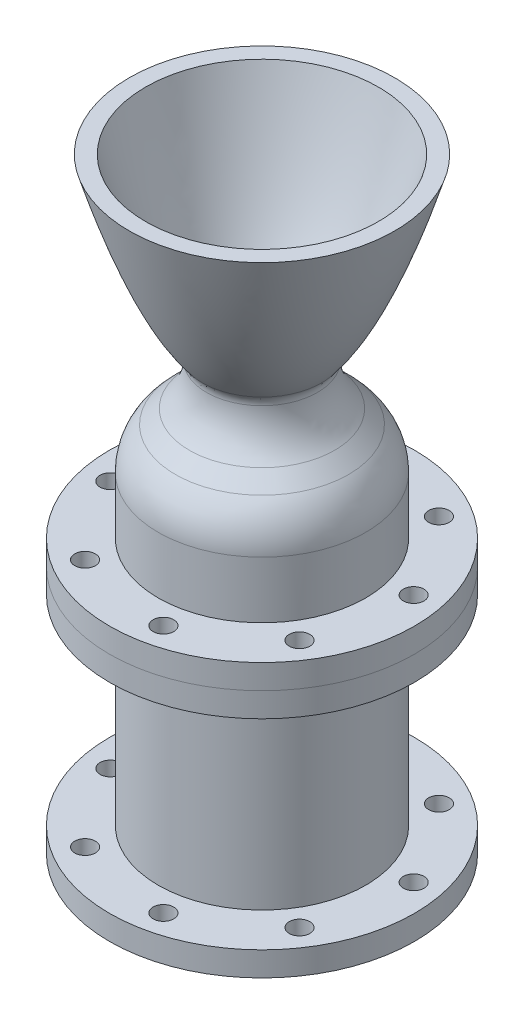
from build123d import *

# Parameters (mm, degrees)
SKETCH2_R           = 93.881527661
SKETCH2_R_2         = 63.881527661
BOSS_EXTRUDE1_DEPTH = 15
BOSS_EXTRUDE2_START = 15
SKETCH3_R           = 93.881527661
SKETCH3_R_2         = 63.881527661
BOSS_EXTRUDE2_DEPTH = 15
CIRPATTERN1_COUNT   = 8


with BuildPart() as part:
    # Sketch1 → Revolve2 (revolve)
    with BuildSketch(Plane.XY, mode=Mode.PRIVATE) as revolve2_sk:
        with BuildLine():
            Line((71.727523603, 109.92750764), (81.727523603, 109.92750764))
            add(Edge.make_bspline(
                [(36.834819916, 6.492229985), (59.290187444, 34.627531396), (81.727523603, 109.92750764)],
                knots=[0, 0, 0, 1, 1, 1], degree=2))
            add(Edge.make_bspline(
                [(34.138608587, -0.017009666), (34.138609214, 0.018882986), (34.139147045, 0.093104024), (34.141564436, 0.250631404), (34.148002281, 0.410054451), (34.160074312, 0.629754601), (34.1809758, 0.884423662), (34.214725432, 1.185527607), (34.266040019, 1.525040832), (34.330084415, 1.863987111), (34.406682315, 2.199344754), (34.495864285, 2.532229755), (34.597282126, 2.861082979), (34.711159784, 3.186337375), (34.836737485, 3.506617492), (34.97482669, 3.822657067), (35.123611014, 4.132272519), (35.285552936, 4.437773457), (35.456029218, 4.73429191), (35.642055434, 5.028694196), (35.831328983, 5.30850927), (36.043946188, 5.593717877), (36.218417088, 5.815903982), (36.405886469, 6.032941971), (36.544095961, 6.19163198), (36.709982784, 6.365112113), (36.784060974, 6.441469176), (36.834819916, 6.492229985)],
                knots=[0.082568816, 0.082568816, 0.082568816, 0.082568816, 0.082568816, 0.102426634, 0.122284453, 0.142142271, 0.162000089, 0.201715725, 0.241431362, 0.281146998, 0.320862634, 0.360578271, 0.400293907, 0.440009544, 0.47972518, 0.519440816, 0.559156453, 0.598872089, 0.638587725, 0.678303362, 0.718018998, 0.757734635, 0.797450271, 0.837165907, 0.857023726, 0.876881544, 0.91659718, 0.91659718, 0.91659718, 0.91659718, 0.91659718], degree=4))
            add(Edge.make_bspline(
                [(34.138608587, -0.017009666), (34.138609818, -0.087538311), (34.139138965, -0.230593854), (34.141514651, -0.56019258), (34.147839045, -0.841170061), (34.157324166, -1.211831735), (34.169966459, -1.530444722), (34.185766683, -1.878949267), (34.204721942, -2.210716536), (34.232359556, -2.635079064), (34.271827763, -3.139043611), (34.342840424, -3.896988339), (34.462667396, -4.903460052), (34.639026763, -6.073720425), (34.890425953, -7.40217608), (35.191336035, -8.72058418), (35.541311346, -10.026646874), (35.939901707, -11.318829263), (36.386486117, -12.595109002), (36.880544049, -13.853897151), (37.42121385, -15.093206797), (38.008020115, -16.311619463), (38.639680128, -17.506948464), (39.316073127, -18.678297428), (40.034985834, -19.822753068), (40.797562733, -20.940869747), (41.498707927, -21.891421434), (42.128276858, -22.690455155), (42.663669152, -23.337431813), (43.111796504, -23.857014692), (43.547990763, -24.346825923), (43.975366859, -24.805494067), (44.285099377, -25.130877988), (44.576400695, -25.426658725), (44.675953163, -25.52695961), (44.725823541, -25.576831795)],
                knots=[0.082637729, 0.082637729, 0.082637729, 0.082637729, 0.082637729, 0.092574926, 0.102512123, 0.11244932, 0.122386517, 0.132323714, 0.142260911, 0.152198108, 0.162135305, 0.182009699, 0.201884093, 0.24163288, 0.281381668, 0.321130456, 0.360879243, 0.400628031, 0.440376819, 0.480125606, 0.519874394, 0.559623181, 0.599371969, 0.639120757, 0.678869544, 0.718618332, 0.75836712, 0.798115907, 0.817990301, 0.837864695, 0.857739089, 0.877613483, 0.897487877, 0.907425074, 0.91736227, 0.91736227, 0.91736227, 0.91736227, 0.91736227], degree=4))
            Line((44.725823541, -25.576831795), (53.333451739, -34.184459993))
            add(Edge.make_bspline(
                [(63.881527661, -59.7610264), (63.881635503, -59.690496419), (63.881325305, -59.548918717), (63.879465733, -59.215073955), (63.873569156, -58.938295382), (63.864659319, -58.566053153), (63.852510889, -58.246304117), (63.833426989, -57.81503091), (63.804188899, -57.314350552), (63.760893785, -56.721321154), (63.683287498, -55.881682335), (63.584725547, -55.041214402), (63.465267047, -54.205298233), (63.29694877, -53.205026548), (63.103741077, -52.20974415), (62.879581588, -51.220492573), (62.624738162, -50.239047247), (62.34552051, -49.264202982), (62.042075876, -48.296624041), (61.652992584, -47.179186843), (61.160922286, -45.919697704), (60.622053079, -44.679423275), (60.037264967, -43.460250183), (59.407173996, -42.26366605), (58.732990622, -41.091683685), (58.015112762, -39.945389917), (57.255467536, -38.827317394), (56.553708502, -37.873606552), (55.928608776, -37.076859239), (55.388897914, -36.423732972), (54.951995064, -35.913923057), (54.55233645, -35.466049486), (54.219578542, -35.103172981), (53.912547537, -34.778406744), (53.713018447, -34.569307229), (53.483698766, -34.335919151), (53.383246706, -34.234409451), (53.333451739, -34.184459993)],
                knots=[0.082637729, 0.082637729, 0.082637729, 0.082637729, 0.082637729, 0.092574926, 0.102512123, 0.11244932, 0.122386517, 0.132323714, 0.142260911, 0.162135305, 0.182009699, 0.201884093, 0.24163288, 0.261507274, 0.281381668, 0.321130456, 0.360879243, 0.380753637, 0.400628031, 0.440376819, 0.480125606, 0.519874394, 0.559623181, 0.599371969, 0.639120757, 0.678869544, 0.718618332, 0.75836712, 0.798115907, 0.817990301, 0.837864695, 0.857739089, 0.877613483, 0.88755068, 0.897487877, 0.907425074, 0.91736227, 0.91736227, 0.91736227, 0.91736227, 0.91736227], degree=4))
            Line((63.881527661, -59.7610264), (63.881527661, -262.944683548))
            Line((63.881527661, -262.944683548), (53.881527661, -262.927513222))
            Line((53.881527661, -262.927513222), (53.881527661, -59.727513222))
            add(Edge.make_bspline(
                [(53.881527661, -59.727513222), (53.88152643, -59.656983159), (53.880997287, -59.515406106), (53.878621437, -59.181564619), (53.872296838, -58.904795495), (53.862811351, -58.53256749), (53.850168453, -58.212837625), (53.830417626, -57.781594445), (53.800405285, -57.280959902), (53.756193122, -56.687998168), (53.677288452, -55.848480369), (53.577426862, -55.008165863), (53.456675787, -54.172435433), (53.286810823, -53.172425243), (53.092064187, -52.177442824), (52.866375121, -51.188539086), (52.610014225, -50.207489041), (52.329289341, -49.233077743), (52.02434874, -48.265969226), (51.633537832, -47.14913507), (51.139520362, -45.890408408), (50.598733754, -44.650968806), (50.012060929, -43.432701528), (49.380120232, -42.237093241), (48.70412523, -41.066154881), (47.984475521, -39.92097266), (47.223102139, -38.804076241), (46.519869062, -37.851451787), (45.893537939, -37.055672125), (45.352817682, -36.403381284), (44.91512695, -35.894247635), (44.514776191, -35.446992659), (44.181457505, -35.084631187), (43.873924626, -34.760340153), (43.674072408, -34.551549453), (43.444392074, -34.31851629), (43.343783153, -34.217162057), (43.293911001, -34.167289665)],
                knots=[0.082637729, 0.082637729, 0.082637729, 0.082637729, 0.082637729, 0.092574926, 0.102512123, 0.11244932, 0.122386517, 0.132323714, 0.142260911, 0.162135305, 0.182009699, 0.201884093, 0.24163288, 0.261507274, 0.281381668, 0.321130456, 0.360879243, 0.380753637, 0.400628031, 0.440376819, 0.480125606, 0.519874394, 0.559623181, 0.599371969, 0.639120757, 0.678869544, 0.718618332, 0.75836712, 0.798115907, 0.817990301, 0.837864695, 0.857739089, 0.877613483, 0.88755068, 0.897487877, 0.907425074, 0.91736227, 0.91736227, 0.91736227, 0.91736227, 0.91736227], degree=4))
            Line((43.293911001, -34.167289665), (34.686282803, -25.559661467))
            add(Edge.make_bspline(
                [(24.099067874, 0.000160672), (24.099069105, -0.070367973), (24.099598252, -0.213423516), (24.101973937, -0.543022242), (24.108298331, -0.823999723), (24.117783452, -1.194661398), (24.130425744, -1.513274384), (24.146225968, -1.861778929), (24.165181227, -2.193546198), (24.19281884, -2.617908726), (24.232287047, -3.121873273), (24.303299707, -3.879818001), (24.423126678, -4.886289715), (24.599486044, -6.056550087), (24.850885233, -7.385005742), (25.151795313, -8.703413843), (25.501770623, -10.009476538), (25.900360983, -11.301658927), (26.346945391, -12.577938666), (26.841003322, -13.836726816), (27.381673121, -15.076036462), (27.968479386, -16.294449129), (28.600139397, -17.48977813), (29.276532395, -18.661127095), (29.995445101, -19.805582736), (30.758021999, -20.923699416), (31.459167192, -21.874251103), (32.088736123, -22.673284825), (32.624128416, -23.320261484), (33.072255768, -23.839844363), (33.508450026, -24.329655594), (33.935826121, -24.788323738), (34.245558639, -25.11370766), (34.536859957, -25.409488397), (34.636412425, -25.509789282), (34.686282803, -25.559661467)],
                knots=[0.082637729, 0.082637729, 0.082637729, 0.082637729, 0.082637729, 0.092574926, 0.102512123, 0.11244932, 0.122386517, 0.132323714, 0.142260911, 0.152198108, 0.162135305, 0.182009699, 0.201884093, 0.24163288, 0.281381668, 0.321130456, 0.360879243, 0.400628031, 0.440376819, 0.480125606, 0.519874394, 0.559623181, 0.599371969, 0.639120757, 0.678869544, 0.718618332, 0.75836712, 0.798115907, 0.817990301, 0.837864695, 0.857739089, 0.877613483, 0.897487877, 0.907425074, 0.91736227, 0.91736227, 0.91736227, 0.91736227, 0.91736227], degree=4))
            add(Edge.make_bspline(
                [(24.099067874, 0.000160672), (24.0990685, 0.036053324), (24.099606331, 0.110274362), (24.102023723, 0.267801742), (24.108461568, 0.427224789), (24.120533599, 0.646924939), (24.141435087, 0.901594), (24.175184719, 1.202697945), (24.226499305, 1.54221117), (24.290543701, 1.881157449), (24.367141601, 2.216515092), (24.456323571, 2.549400093), (24.557741413, 2.878253317), (24.671619071, 3.203507713), (24.797196771, 3.523787829), (24.935285977, 3.839827405), (25.084070301, 4.149442857), (25.246012222, 4.454943795), (25.416488505, 4.751462248), (25.602514721, 5.045864533), (25.79178827, 5.325679608), (26.004405474, 5.610888215), (26.178876374, 5.83307432), (26.366345756, 6.050112309), (26.504555248, 6.208802318), (26.67044207, 6.382282451), (26.744520261, 6.458639514), (26.795279203, 6.509400323)],
                knots=[0.082568816, 0.082568816, 0.082568816, 0.082568816, 0.082568816, 0.102426634, 0.122284453, 0.142142271, 0.162000089, 0.201715725, 0.241431362, 0.281146998, 0.320862634, 0.360578271, 0.400293907, 0.440009544, 0.47972518, 0.519440816, 0.559156453, 0.598872089, 0.638587725, 0.678303362, 0.718018998, 0.757734635, 0.797450271, 0.837165907, 0.857023726, 0.876881544, 0.91659718, 0.91659718, 0.91659718, 0.91659718, 0.91659718], degree=4))
            add(Edge.make_bspline(
                [(26.795279203, 6.509400323), (49.261401403, 34.636114842), (71.727523603, 109.92750764)],
                knots=[0, 0, 0, 1, 1, 1], degree=2))
        make_face()
    revolve(revolve2_sk.sketch.rotate(Axis((-0.005532126, 165.815985114, 0), (0, -1, 0)), 180), axis=Axis((-0.005532126, 165.815985114, 0), (0, -1, 0)))

    # Sketch2 → Boss-Extrude1 (add, symmetric)
    with BuildSketch(Plane(origin=(0, -109.744683548, 0), x_dir=(1, 0, 0), z_dir=(0, 1, 0))):
        with Locations(Location((0, 0, 0), (0, 0, 270))):
            Circle(SKETCH2_R)
        Circle(SKETCH2_R_2, mode=Mode.SUBTRACT)
    extrude(amount=BOSS_EXTRUDE1_DEPTH, both=True)

    # Sketch3 → Boss-Extrude2 (add)
    with BuildSketch(Plane(origin=(0, -262.944683548, 0), x_dir=(1, 0, 0), z_dir=(0, 1, 0)).offset(BOSS_EXTRUDE2_START)):
        with Locations(Location((0, 0, 0), (0, 0, 270))):
            Circle(SKETCH3_R)
        Circle(SKETCH3_R_2, mode=Mode.SUBTRACT)
    extrude(amount=-BOSS_EXTRUDE2_DEPTH)

    # Sketch6 → 1/2 (0.5) Diameter Hole1 (revolve, cut)
    with BuildSketch(Plane(origin=(-42.929097791, -262.944683548, 66.034195532), x_dir=(0, 0, -1), z_dir=(1, 0, 0))):
        Polygon((0, 0), (0, 203.815464931), (6.35, 200), (6.35, 0), align=None)
    f_1_2_0_5_diameter_hole1 = revolve(axis=Axis((-42.929097791, -269.294683548, 66.034195532), (0, 1, 0)), mode=Mode.SUBTRACT)

    # CirPattern1: 1/2 (0.5) Diameter Hole1 ×8 about axis
    cirpattern1_axis = Axis((0, 0, 0), (0, 1, 0))
    for i in range(1, CIRPATTERN1_COUNT):
        add(f_1_2_0_5_diameter_hole1.rotate(cirpattern1_axis, i * 360 / CIRPATTERN1_COUNT), mode=Mode.SUBTRACT)


with BuildPart() as body_2:
    # Split1: the piece on the far side of the plane
    add(part.part)
    split(bisect_by=Plane.ZX.offset(-109.744683548), keep=Keep.BOTTOM)


with BuildPart() as part_1:
    add(part.part)

    # Split1
    split(bisect_by=Plane.ZX.offset(-109.744683548), keep=Keep.TOP)


solid = Compound([body_2.part, part_1.part])
